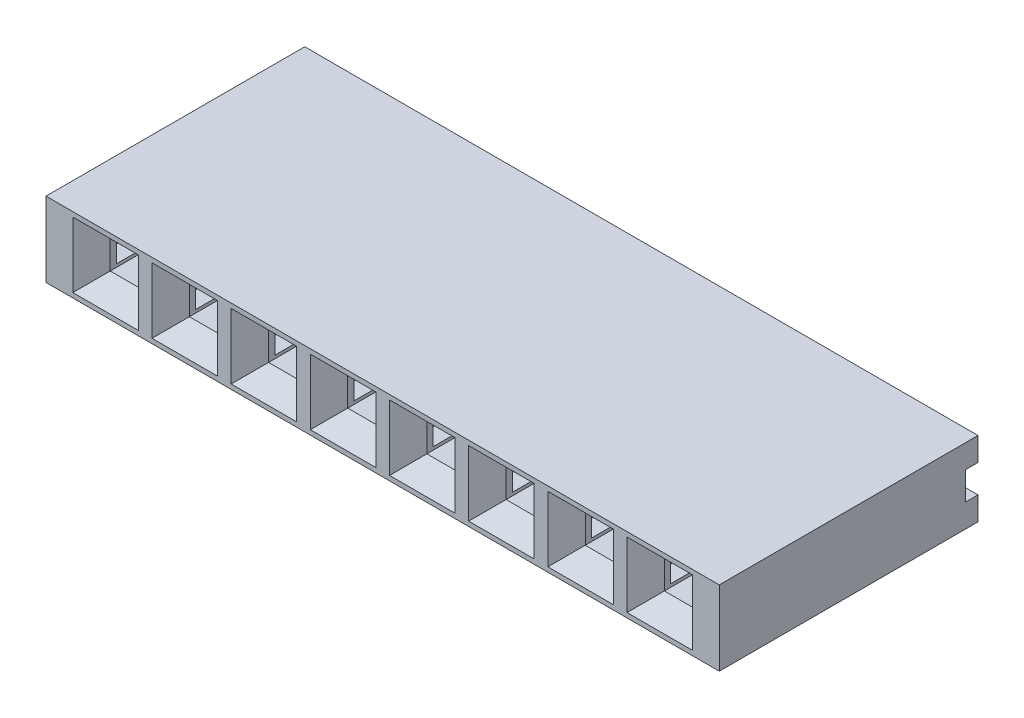
from build123d import *

# Parameters (mm, degrees)
EXTRUDE_699_DEPTH         = 6.7
EXTRUDE_699_DEPTH_BACK    = 0.4
SKETCH_222_W              = 2.54
SKETCH_222_H              = 2.4
SKETCH_753_W              = 2.54
SKETCH_753_H              = 0.75
EXTRUDE_1132_DEPTH        = 0.4
SKETCH_1186_W             = 2.54
SKETCH_1186_H             = 2.4
SKETCH_1186_W_2           = 0.9
SKETCH_1186_H_2           = 0.9
EXTRUDE_1471_DEPTH        = 0.8
CHAMFER_1532_SIZE         = 0.6
PATTERN_LINEAR_1658_COUNT = 8
PATTERN_LINEAR_1658_PITCH = 2.54
EXTRUDE_1_DEPTH           = 0.64
EXTRUDE_START             = -20.96
EXTRUDE_2_DEPTH           = 0.64


with BuildPart() as part:
    # Sketch 222 → Extrude 699 (new, two sides: drawn at the far end of the back side and taken through both)
    with BuildSketch(Plane.XY.offset(-EXTRUDE_699_DEPTH_BACK)):
        Rectangle(SKETCH_222_W, SKETCH_222_H)
        Polygon((-1, 0.35), (-0.45, 0.35), (-0.45, 0.45), (0.45, 0.45), (0.45, 0.35), (1, 0.35), (1, -0.35), (0.45, -0.35), (0.45, -0.45), (-0.45, -0.45), (-0.45, -0.35), (-1, -0.35), align=None, mode=Mode.SUBTRACT)
    extrude(amount=EXTRUDE_699_DEPTH + EXTRUDE_699_DEPTH_BACK)

    # Sketch 753 → Extrude 1132 (add)
    with BuildSketch(Plane(origin=(0, 0, -0.4), x_dir=(-1, 0, 0), z_dir=(0, 0, -1))):
        with Locations((0, -0.825)):
            Rectangle(SKETCH_753_W, SKETCH_753_H)
        with Locations((0, 0.825)):
            Rectangle(SKETCH_753_W, SKETCH_753_H)
    extrude(amount=EXTRUDE_1132_DEPTH)

    # Sketch 1186 → Extrude 1471 (add)
    with BuildSketch(Plane.XY.offset(6.7)):
        Rectangle(SKETCH_1186_W, SKETCH_1186_H)
        Rectangle(SKETCH_1186_W_2, SKETCH_1186_H_2, mode=Mode.SUBTRACT)
    extrude(amount=EXTRUDE_1471_DEPTH)

    # Chamfer 1532
    chamfer_1532_edges = [part.edges().sort_by_distance(p)[0] for p in [
        (0.45, 0, 7.5),
        (0, 0.45, 7.5),
        (-0.45, 0, 7.5),
        (0, -0.45, 7.5),
    ]]
    chamfer(chamfer_1532_edges, length=CHAMFER_1532_SIZE)


with BuildPart() as pattern_linear_1658_1:
    # Pattern Linear 1658: pattern copy
    add(part.part.moved(Location(Vector(-1, 0, 0) * (1 * PATTERN_LINEAR_1658_PITCH))))


with BuildPart() as pattern_linear_1658_2:
    # Pattern Linear 1658: pattern copy
    add(part.part.moved(Location(Vector(-1, 0, 0) * (2 * PATTERN_LINEAR_1658_PITCH))))


with BuildPart() as pattern_linear_1658_3:
    # Pattern Linear 1658: pattern copy
    add(part.part.moved(Location(Vector(-1, 0, 0) * (3 * PATTERN_LINEAR_1658_PITCH))))


with BuildPart() as pattern_linear_1658_4:
    # Pattern Linear 1658: pattern copy
    add(part.part.moved(Location(Vector(-1, 0, 0) * (4 * PATTERN_LINEAR_1658_PITCH))))


with BuildPart() as pattern_linear_1658_5:
    # Pattern Linear 1658: pattern copy
    add(part.part.moved(Location(Vector(-1, 0, 0) * (5 * PATTERN_LINEAR_1658_PITCH))))


with BuildPart() as pattern_linear_1658_6:
    # Pattern Linear 1658: pattern copy
    add(part.part.moved(Location(Vector(-1, 0, 0) * (6 * PATTERN_LINEAR_1658_PITCH))))


with BuildPart() as pattern_linear_1658_7:
    # Pattern Linear 1658: pattern copy
    add(part.part.moved(Location(Vector(-1, 0, 0) * (7 * PATTERN_LINEAR_1658_PITCH))))


with BuildPart() as part_1:
    add(part.part)

    # Combine 1774: union Pattern Linear 1658_7, Pattern Linear 1658_6, Pattern Linear 1658_5, Pattern Linear 1658_4, Pattern Linear 1658_3, Pattern Linear 1658_2, Pattern Linear 1658_1
    add(pattern_linear_1658_7.part)
    add(pattern_linear_1658_6.part)
    add(pattern_linear_1658_5.part)
    add(pattern_linear_1658_4.part)
    add(pattern_linear_1658_3.part)
    add(pattern_linear_1658_2.part)
    add(pattern_linear_1658_1.part)

    # Sketch 2582 → Бобышка-БоковаяНакладка1 (add)
    with BuildSketch(Plane(origin=(1.27, 0, 0), x_dir=(0, 0, -1), z_dir=(1, 0, 0))):
        Polygon((0.8, 1.2), (0.8, 0.45), (0.4, 0.45), (0.4, -0.45), (0.8, -0.45), (0.8, -1.2), (-7.5, -1.2), (-7.5, 1.2), align=None)
    extrude(amount=EXTRUDE_1_DEPTH)

    # Эскиз-БоковаяНакладка<2> → Бобышка-БоковаяНакладка2 (add)
    with BuildSketch(Plane(origin=(1.27, 0, 0), x_dir=(0, 0, -1), z_dir=(1, 0, 0)).offset(EXTRUDE_START)):
        Polygon((0.8, 1.2), (0.8, 0.45), (0.4, 0.45), (0.4, -0.45), (0.8, -0.45), (0.8, -1.2), (-7.5, -1.2), (-7.5, 1.2), align=None)
    extrude(amount=EXTRUDE_2_DEPTH)


solid = part_1.part
